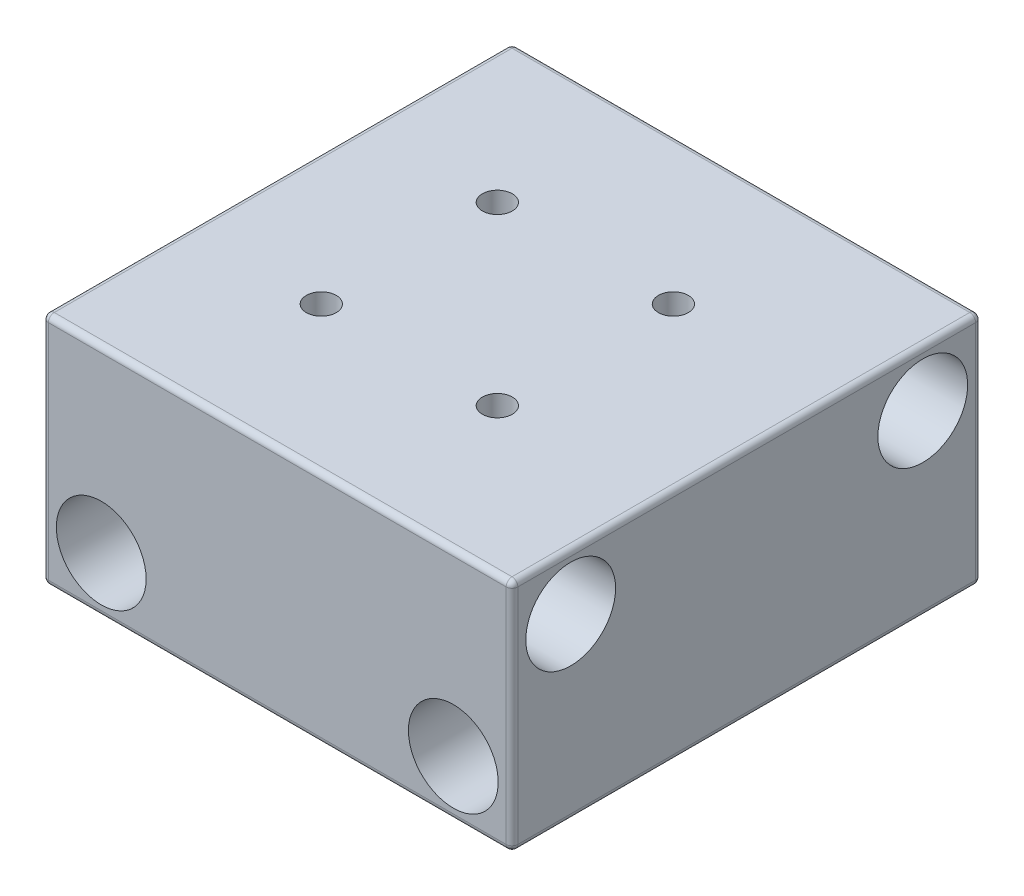
from build123d import *

# Parameters (mm, degrees)
SKETCH1_W           = 80
SKETCH1_H           = 80
BOSS_EXTRUDE1_DEPTH = 20
SKETCH3_R           = 4.5
CUT_EXTRUDE2_DEPTH  = 92.651513899
SKETCH3_4_R         = 7.65
SKETCH3_4_R_2       = 4.5
CUT_EXTRUDE3_DEPTH  = 24.5
SKETCH7_R           = 4.5
CUT_EXTRUDE4_DEPTH  = 92.651513899
SKETCH7_4_R         = 7.65
SKETCH7_4_R_2       = 4.5
CUT_EXTRUDE5_DEPTH  = 24.5
FILLET1_R           = 1
SKETCH8_R           = 2.55
CUT_EXTRUDE7_DEPTH  = 70.282032303


with BuildPart() as part:
    # Sketch1 → Boss-Extrude1 (new, symmetric)
    with BuildSketch(Plane(origin=(0, 0, 0), x_dir=(1, 0, 0), z_dir=(0, 1, 0))):
        Rectangle(SKETCH1_W, SKETCH1_H)
    extrude(amount=BOSS_EXTRUDE1_DEPTH, both=True)

    # Sketch3 → Cut-Extrude2 (cut, through all)
    with BuildSketch(Plane.XY.offset(40)):
        with Locations((-30, -10.5)):
            Circle(SKETCH3_R)
        with Locations((30, -10.5)):
            Circle(SKETCH3_R)
    extrude(amount=-CUT_EXTRUDE2_DEPTH, mode=Mode.SUBTRACT)

    # Sketch3<4> → Cut-Extrude3 (cut)
    # profile 1 of 2: a face of its own
    with BuildSketch(Plane.XY.offset(40)):
        with Locations((-30, -10.5)):
            Circle(SKETCH3_4_R)
        with Locations((-30, -10.5)):
            Circle(SKETCH3_4_R_2, mode=Mode.SUBTRACT)
    # profile 2 of 2: a face of its own
    with BuildSketch(Plane.XY.offset(40)):
        with Locations((30, -10.5)):
            Circle(SKETCH3_4_R)
        with Locations((30, -10.5)):
            Circle(SKETCH3_4_R_2, mode=Mode.SUBTRACT)
    cut_extrude3 = extrude(amount=-CUT_EXTRUDE3_DEPTH, mode=Mode.SUBTRACT)

    # Mirror1: Cut-Extrude3 across plane
    add(cut_extrude3.mirror(Plane.XY), mode=Mode.SUBTRACT)

    # Sketch7 → Cut-Extrude4 (cut, through all)
    with BuildSketch(Plane(origin=(40, 0, 0), x_dir=(0, 0, -1), z_dir=(1, 0, 0))):
        with Locations((-30, 10.5)):
            Circle(SKETCH7_R)
        with Locations((30, 10.5)):
            Circle(SKETCH7_R)
    extrude(amount=-CUT_EXTRUDE4_DEPTH, mode=Mode.SUBTRACT)

    # Sketch7<4> → Cut-Extrude5 (cut)
    # profile 1 of 2: a face of its own
    with BuildSketch(Plane(origin=(40, 0, 0), x_dir=(0, 0, -1), z_dir=(1, 0, 0))):
        with Locations((-30, 10.5)):
            Circle(SKETCH7_4_R)
        with Locations((-30, 10.5)):
            Circle(SKETCH7_4_R_2, mode=Mode.SUBTRACT)
    # profile 2 of 2: a face of its own
    with BuildSketch(Plane(origin=(40, 0, 0), x_dir=(0, 0, -1), z_dir=(1, 0, 0))):
        with Locations((30, 10.5)):
            Circle(SKETCH7_4_R)
        with Locations((30, 10.5)):
            Circle(SKETCH7_4_R_2, mode=Mode.SUBTRACT)
    cut_extrude5 = extrude(amount=-CUT_EXTRUDE5_DEPTH, mode=Mode.SUBTRACT)

    # Mirror2: Cut-Extrude5 across plane
    add(cut_extrude5.mirror(Plane(origin=(0, 0, 0), x_dir=(0, 0, 1), z_dir=(1, 0, 0))), mode=Mode.SUBTRACT)

    # Fillet1
    fillet1_edges = [part.edges().sort_by_distance(p)[0] for p in [
        (0, -20, 40),
        (0, 20, 40),
        (-40, 0, 40),
        (-40, -20, 0),
        (-40, 20, 0),
        (-40, 0, -40),
        (0, -20, -40),
        (0, 20, -40),
        (40, 20, 0),
        (40, 0, -40),
        (40, -20, 0),
        (40, 0, 40),
    ]]
    fillet(fillet1_edges, radius=FILLET1_R)

    # Sketch8 → Cut-Extrude7 (cut, through all)
    with BuildSketch(Plane(origin=(0, 20, 0), x_dir=(1, 0, 0), z_dir=(0, 1, 0))):
        with Locations((-17.5, 15)):
            Circle(SKETCH8_R)
        with Locations((12.5, 15)):
            Circle(SKETCH8_R)
        with Locations((12.5, -15)):
            Circle(SKETCH8_R)
        with Locations((-17.5, -15)):
            Circle(SKETCH8_R)
    extrude(amount=-CUT_EXTRUDE7_DEPTH, mode=Mode.SUBTRACT)


solid = part.part
